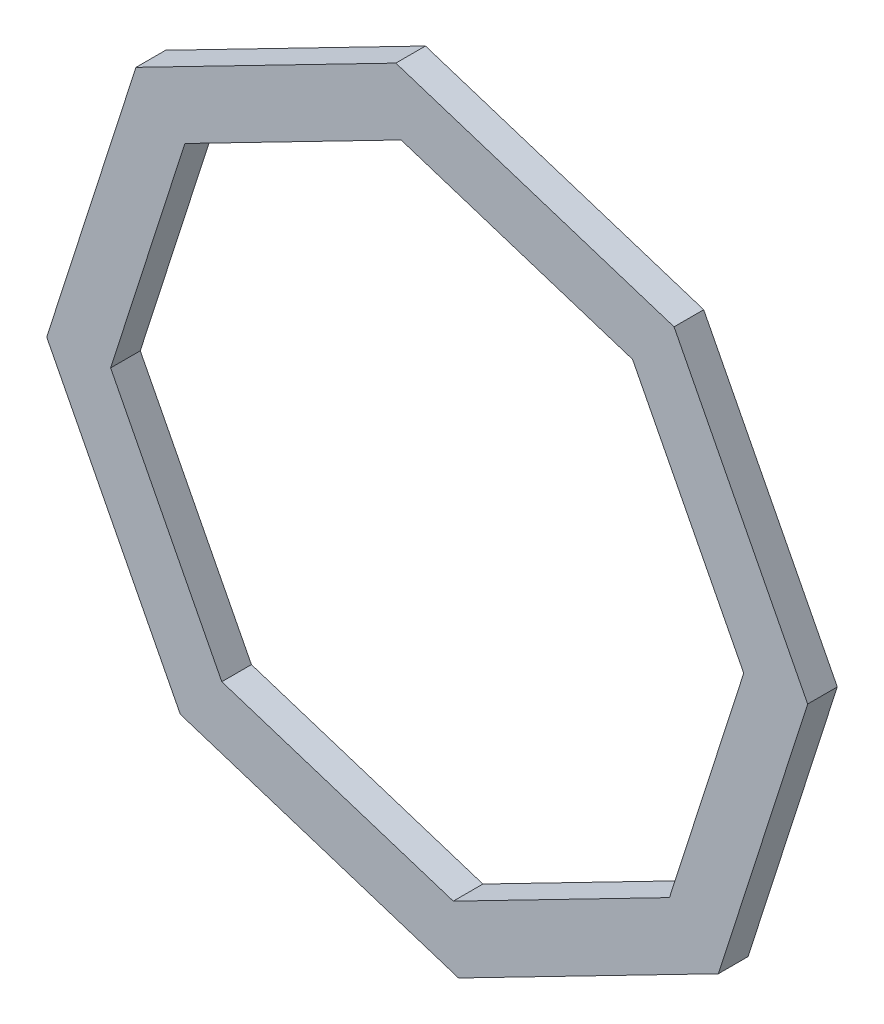
from build123d import *

# Parameters (mm, degrees)
EXTRUDE_1_DEPTH = 5


with BuildPart() as part:
    # 草图1 → 凸台-拉伸1 (new body)
    with BuildSketch(Plane.XY):
        Polygon((41.659438275, 49.142048048), (-5.291004111, 64.20634672), (-49.142048048, 41.659438275), (-64.20634672, -5.291004111), (-41.659438275, -49.142048048), (5.291004111, -64.20634672), (49.142048048, -41.659438275), (64.20634672, 5.291004111), align=None)
        Polygon((34.660204694, 40.885655567), (-4.402058528, 53.418990081), (-40.885655567, 34.660204694), (-53.418990081, -4.402058528), (-34.660204694, -40.885655567), (4.402058528, -53.418990081), (40.885655567, -34.660204694), (53.418990081, 4.402058528), align=None, mode=Mode.SUBTRACT)
    extrude(amount=EXTRUDE_1_DEPTH)


solid = part.part
